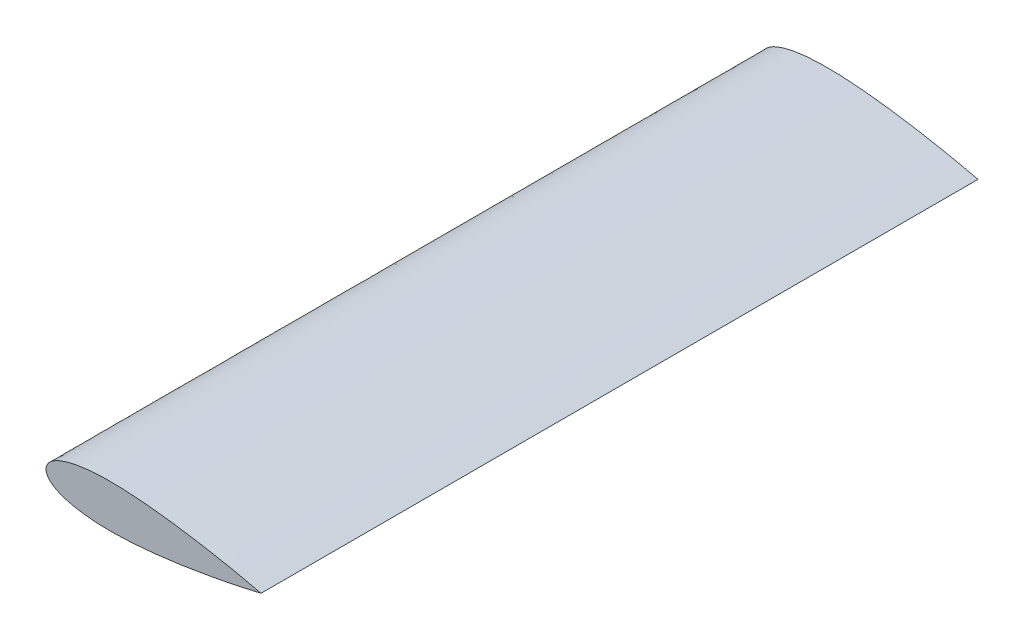
from build123d import *

# Parameters (mm, degrees)
EXTRUDE_1_DEPTH = 1000


with BuildPart() as part:
    # 草图2 → 凸台-拉伸1 (new body)
    with BuildSketch(Plane.XY):
        with BuildLine():
            add(Edge.make_bspline(
                [(0, 0), (-0.00021229, 0.506970744), (0.044864754, 1.381714413), (0.226017079, 2.650839475), (0.688025344, 4.299952552), (1.335546305, 5.873041675), (2.26695445, 7.542579189), (3.571946964, 9.346109572), (5.391381815, 11.324673938), (7.954469743, 13.539518757), (11.584975672, 16.021510412), (16.648123966, 18.726988569), (23.793189999, 21.649781435), (33.085765079, 24.436937203), (46.643058908, 27.284493785), (64.063199307, 29.362693495), (84.450847037, 30.260343335), (107.414943041, 29.859960777), (130.332556147, 28.428346139), (153.186136376, 26.214758658), (175.970846287, 23.391654718), (195.848592789, 20.487628812), (212.844945694, 17.732999103), (226.980485609, 15.27094618), (238.271313866, 13.203878393), (248.135151077, 11.310105462), (256.577305747, 9.625486685), (263.604664912, 8.179483676), (269.219788458, 6.997398786), (274.1309907, 5.93944771), (278.331979904, 5.017052178), (281.838528118, 4.234963306), (284.626645762, 3.606112196), (287.446648095, 2.96209323), (290.200347561, 2.326575377), (293.076089097, 1.653806717), (295.700233887, 1.034172197), (298.078453528, 0.464134202), (299.365470759, 0.153714709), (299.999999997, 1e-09)],
                knots=[0, 0, 0, 0, 0, 0.005874531, 0.010168378, 0.014828146, 0.019835444, 0.025574736, 0.032308878, 0.040609511, 0.050966894, 0.064812119, 0.083253248, 0.107120705, 0.140429682, 0.177263566, 0.243881637, 0.310499708, 0.377117784, 0.443735861, 0.510353937, 0.576972013, 0.643590091, 0.67689913, 0.710208169, 0.743517207, 0.776826246, 0.793480766, 0.810135286, 0.826789806, 0.843444325, 0.851771585, 0.860098845, 0.868426105, 0.876753365, 0.885080625, 0.893407884, 0.901735144, 0.910062404, 0.910062404, 0.910062404, 0.910062404, 0.910062404], degree=4))
            add(Edge.make_bspline(
                [(0, 0), (-0.00021229, -0.506970744), (0.044864754, -1.381714413), (0.226017079, -2.650839475), (0.688025344, -4.299952552), (1.335546305, -5.873041675), (2.26695445, -7.542579189), (3.571946964, -9.346109572), (5.391381815, -11.324673938), (7.954469743, -13.539518757), (11.584975672, -16.021510412), (16.648123966, -18.726988569), (23.793189999, -21.649781435), (33.085765079, -24.436937203), (46.643058908, -27.284493785), (64.063199307, -29.362693495), (84.450847037, -30.260343335), (107.414943041, -29.859960777), (130.332556147, -28.428346139), (153.186136376, -26.214758658), (175.970846287, -23.391654718), (195.848592789, -20.487628812), (212.844945694, -17.732999103), (226.980485609, -15.27094618), (238.271313866, -13.203878393), (248.135151077, -11.310105462), (256.577305747, -9.625486685), (263.604664912, -8.179483676), (269.219788458, -6.997398786), (274.1309907, -5.93944771), (278.331979904, -5.017052178), (281.838528118, -4.234963306), (284.626645762, -3.606112196), (287.446648095, -2.96209323), (290.200347561, -2.326575377), (293.076089097, -1.653806717), (295.700233887, -1.034172197), (298.078453528, -0.464134202), (299.365470759, -0.153714709), (299.999999997, 1e-09)],
                knots=[0, 0, 0, 0, 0, 0.005874531, 0.010168378, 0.014828146, 0.019835444, 0.025574736, 0.032308878, 0.040609511, 0.050966894, 0.064812119, 0.083253248, 0.107120705, 0.140429682, 0.177263566, 0.243881637, 0.310499708, 0.377117784, 0.443735861, 0.510353937, 0.576972013, 0.643590091, 0.67689913, 0.710208169, 0.743517207, 0.776826246, 0.793480766, 0.810135286, 0.826789806, 0.843444325, 0.851771585, 0.860098845, 0.868426105, 0.876753365, 0.885080625, 0.893407884, 0.901735144, 0.910062404, 0.910062404, 0.910062404, 0.910062404, 0.910062404], degree=4))
        make_face()
    extrude(amount=EXTRUDE_1_DEPTH)


solid = part.part
